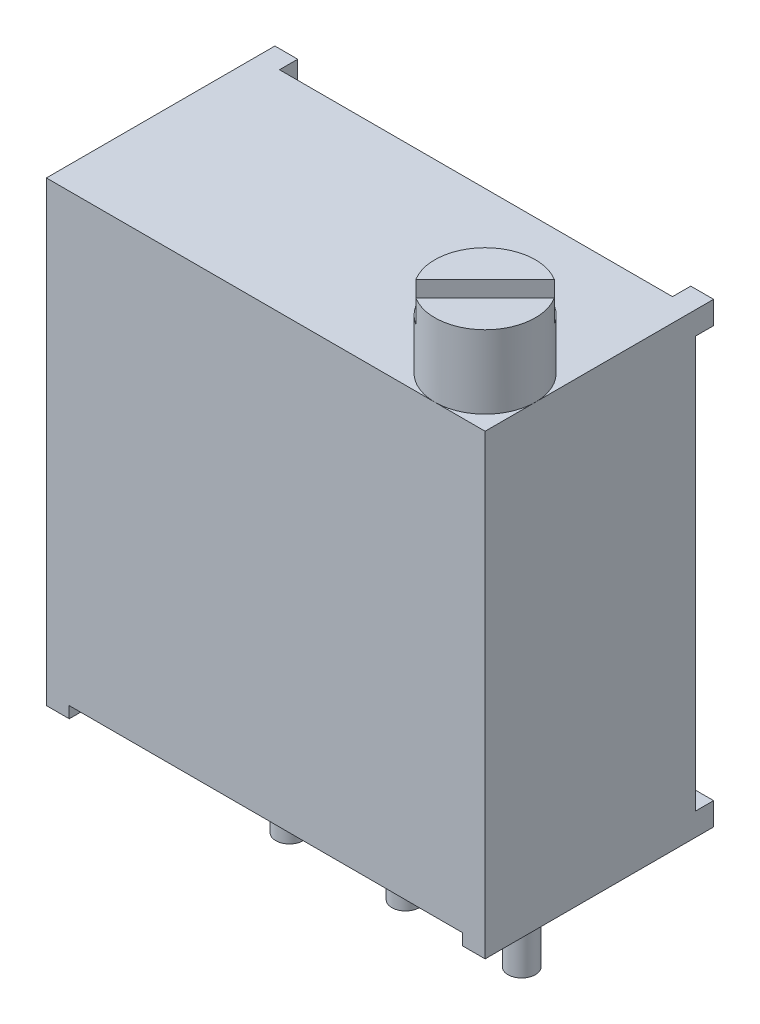
from build123d import *

# Parameters (mm, degrees)
COMPONENT_OUTLINE_W = 9.6
COMPONENT_OUTLINE_H = 5
BOSS_EXTRUDE1_DEPTH = 10
SKETCH1_OUTSIDE_W   = 14.548
SKETCH1_OUTSIDE_H   = 14.948
SKETCH1_OUTSIDE_W_2 = 0.5
SKETCH1_OUTSIDE_H_2 = 0.5
CUT_EXTRUDE1_DEPTH  = 0.4
SKETCH2_W           = 8.6
SKETCH2_H           = 4.6
CUT_EXTRUDE2_DEPTH  = 0.25
SKETCH3_R           = 0.3
BOSS_EXTRUDE2_DEPTH = 3
SKETCH4_R           = 1.1
BOSS_EXTRUDE3_DEPTH = 1.6
CUT_EXTRUDE3_DEPTH  = 0.5


with BuildPart() as part:
    # Component_Outline → Boss-Extrude1 (new body)
    with BuildSketch(Plane(origin=(0, 0, 0), x_dir=(1, 0, 0), z_dir=(0, 1, 0))):
        with Locations((-2.6, -0.5)):
            Rectangle(COMPONENT_OUTLINE_W, COMPONENT_OUTLINE_H)
    extrude(amount=BOSS_EXTRUDE1_DEPTH)

    # Sketch1 outside → Cut-Extrude1 (cut)
    with BuildSketch(Plane(origin=(0, 0, -2), x_dir=(-1, 0, 0), z_dir=(0, 0, -1))):
        with Locations((2.6, 5)):
            Rectangle(SKETCH1_OUTSIDE_W, SKETCH1_OUTSIDE_H)
        with Locations((7.15, 9.75)):
            Rectangle(SKETCH1_OUTSIDE_W_2, SKETCH1_OUTSIDE_H_2, mode=Mode.SUBTRACT)
        with Locations((-1.95, 9.75)):
            Rectangle(SKETCH1_OUTSIDE_W_2, SKETCH1_OUTSIDE_H_2, mode=Mode.SUBTRACT)
        with Locations((-1.95, 0.25)):
            Rectangle(SKETCH1_OUTSIDE_W_2, SKETCH1_OUTSIDE_H_2, mode=Mode.SUBTRACT)
        with Locations((7.15, 0.25)):
            Rectangle(SKETCH1_OUTSIDE_W_2, SKETCH1_OUTSIDE_H_2, mode=Mode.SUBTRACT)
    extrude(amount=-CUT_EXTRUDE1_DEPTH, mode=Mode.SUBTRACT)

    # Sketch2 → Cut-Extrude2 (cut)
    with BuildSketch(Plane.XZ):
        with Locations((-2.6, 0.7)):
            Rectangle(SKETCH2_W, SKETCH2_H)
    extrude(amount=-CUT_EXTRUDE2_DEPTH, mode=Mode.SUBTRACT)

    # Sketch3 → Boss-Extrude2 (add)
    with BuildSketch(Plane.XZ.offset(-0.25)):
        with Locations(Location((0, 0, 0), (0, 0, 90))):
            Circle(SKETCH3_R)
        with Locations(Location((-2.54, 0, 0), (0, 0, 90))):
            Circle(SKETCH3_R)
        with Locations(Location((-5.08, 0, 0), (0, 0, 90))):
            Circle(SKETCH3_R)
    extrude(amount=BOSS_EXTRUDE2_DEPTH)


with BuildPart() as body_2:
    # Sketch4 → Boss-Extrude3 (new body)
    with BuildSketch(Plane(origin=(0, 10, 0), x_dir=(1, 0, 0), z_dir=(0, 1, 0))):
        with Locations(Location((1.1, -1.9, 0), (0, 0, 270))):
            Circle(SKETCH4_R)
    extrude(amount=BOSS_EXTRUDE3_DEPTH)

    # Sketch5 → Cut-Extrude3 (cut)
    with BuildSketch(Plane(origin=(0, 11.6, 0), x_dir=(1, 0, 0), z_dir=(0, 1, 0))):
        with BuildLine():
            Line((0.165760434, -2.480686175), (1.680686175, -0.965760434))
            ThreePointArc((1.680686175, -0.965760434), (1.877817459, -1.122182541), (2.034239566, -1.319313825))
            Line((2.034239566, -1.319313825), (0.519313825, -2.834239566))
            ThreePointArc((0.519313825, -2.834239566), (0.322182541, -2.677817459), (0.165760434, -2.480686175))
        make_face()
    extrude(amount=-CUT_EXTRUDE3_DEPTH, mode=Mode.SUBTRACT)


solid = Compound([part.part, body_2.part])
